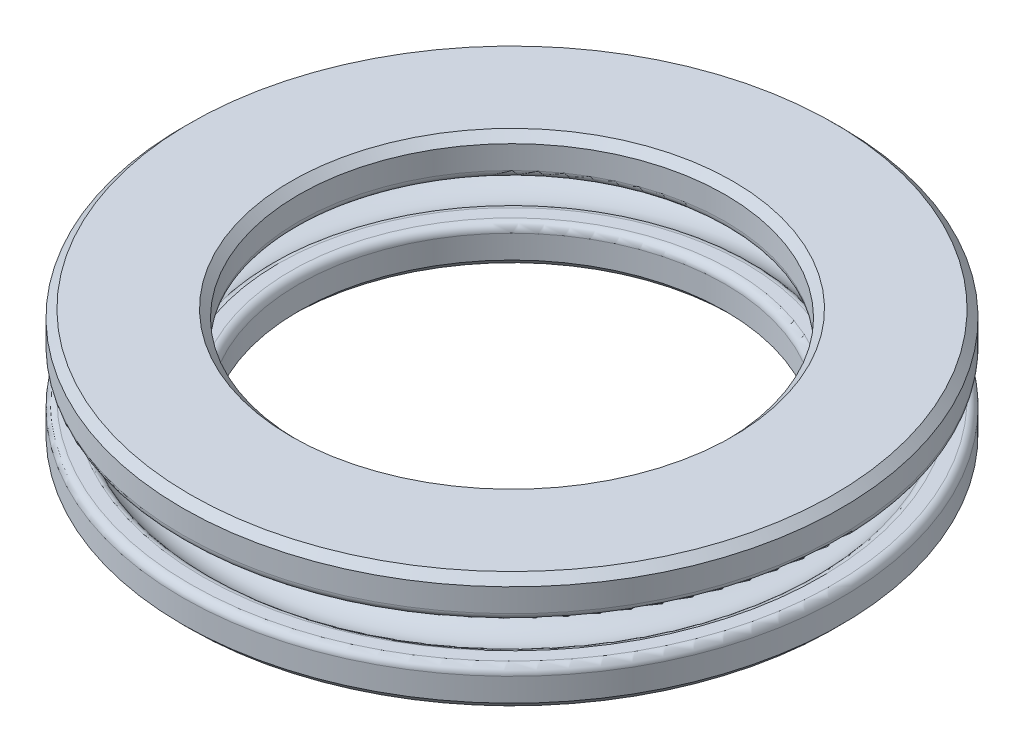
from build123d import *


with BuildPart() as part:
    # Sketch1 → Revolve1 (revolve)
    with BuildSketch(Plane.XY, mode=Mode.PRIVATE) as revolve1_sk:
        with BuildLine():
            Line((-41.5, 5), (-39.873397172, 5))
            ThreePointArc((-39.873397172, 5), (-39.416961708, 4.889756521), (-39.06116431, 4.583333333))
            ThreePointArc((-39.06116431, 4.583333333), (-35, 2.5), (-30.93883569, 4.583333333))
            ThreePointArc((-30.93883569, 4.583333333), (-30.583038292, 4.889756521), (-30.126602828, 5))
            Line((-30.126602828, 5), (-28.5, 5))
            ThreePointArc((-28.5, 5), (-27.792893219, 4.707106781), (-27.5, 4))
            Line((-27.5, 4), (-27.5, 1))
            Line((-27.5, 1), (-28.5, 0))
            Line((-28.5, 0), (-41.5, 0))
            Line((-41.5, 0), (-42.5, 1))
            Line((-42.5, 1), (-42.5, 4))
            ThreePointArc((-42.5, 4), (-42.207106781, 4.707106781), (-41.5, 5))
        make_face()
        with BuildLine():
            Line((-41.5, 15), (-28.5, 15))
            Line((-28.5, 15), (-27.5, 14))
            Line((-27.5, 14), (-27.5, 11))
            ThreePointArc((-27.5, 11), (-27.792893219, 10.292893219), (-28.5, 10))
            Line((-28.5, 10), (-30.126602828, 10))
            ThreePointArc((-30.126602828, 10), (-30.583038292, 10.110243479), (-30.93883569, 10.416666667))
            ThreePointArc((-30.93883569, 10.416666667), (-35, 12.5), (-39.06116431, 10.416666667))
            ThreePointArc((-39.06116431, 10.416666667), (-39.416961708, 10.110243479), (-39.873397172, 10))
            Line((-39.873397172, 10), (-41.5, 10))
            ThreePointArc((-41.5, 10), (-42.207106781, 10.292893219), (-42.5, 11))
            Line((-42.5, 11), (-42.5, 14))
            Line((-42.5, 14), (-41.5, 15))
        make_face()
    revolve(revolve1_sk.sketch.rotate(Axis((0, 36.552301565, 0), (0, -1, 0)), 270), axis=Axis((0, 36.552301565, 0), (0, -1, 0)))


solid = part.part
